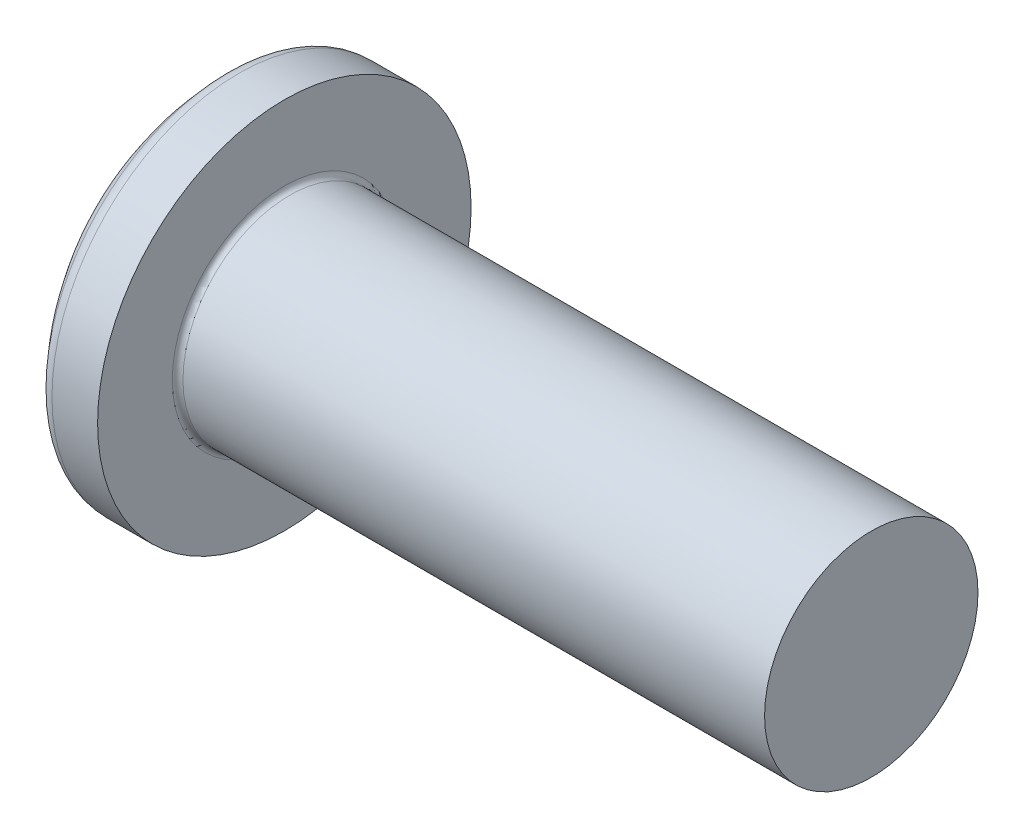
from build123d import *

# Parameters (mm, degrees)
FILLET1_R    = 0.1
RECPAT_COUNT = 2
RECPAT_ANGLE = 90


with BuildPart() as part:
    # BodySke → Base-Revolve (revolve)
    with BuildSketch(Plane.XY, mode=Mode.PRIVATE) as base_revolve_sk:
        with BuildLine():
            Line((2.4, 2), (2.4, 3.5))
            Line((2.4, 3.5), (1.544569491, 3.5))
            ThreePointArc((1.544569491, 3.5), (1.437055787, 3.477670756), (1.347325044, 3.414376321))
            ThreePointArc((1.347325044, 3.414376321), (0.349012213, 1.835296327), (0, 0))
            Line((0, 0), (13.4, 0))
            Line((13.4, 0), (13.4, 2))
            Line((13.4, 2), (2.4, 2))
        make_face()
    revolve(base_revolve_sk.sketch.rotate(Axis((1.544569491, 0, 0), (1, 0, 0)), 90), axis=Axis((1.544569491, 0, 0), (1, 0, 0)))

    # Fillet1
    fillet1_edges = [part.edges().sort_by_distance(p)[0] for p in [
        (2.4, 0, -2),
    ]]
    fillet(fillet1_edges, radius=FILLET1_R)

    # Sketch3 → Recess section 0
    with BuildSketch(Plane(origin=(0, 0, 0), x_dir=(0, 0, -1), z_dir=(1, 0, 0))):
        with BuildLine():
            Line((0.37, -1.4), (-0.37, -1.4))
            Line((-0.37, -1.4), (-0.37, 1.4))
            Line((-0.37, 1.4), (0.37, 1.4))
            Line((0.37, 1.4), (0.37, -1.4))
        make_face()
    # Sketch4 → Recess section 1
    with BuildSketch(Plane(origin=(1.75, 0, 0), x_dir=(0, 0, -1), z_dir=(1, 0, 0))):
        with BuildLine():
            Line((0.37, -0.527482332), (-0.37, -0.527482332))
            Line((-0.37, -0.527482332), (-0.37, 0.527482332))
            Line((-0.37, 0.527482332), (0.37, 0.527482332))
            Line((0.37, 0.527482332), (0.37, -0.527482332))
        make_face()
    recess = loft(mode=Mode.SUBTRACT)

    # RecPat: Recess ×2 about axis
    recpat_axis = Axis((0, 0, 0), (1, 0, 0))
    for i in range(1, RECPAT_COUNT):
        add(recess.rotate(recpat_axis, i * RECPAT_ANGLE / (RECPAT_COUNT - 1)), mode=Mode.SUBTRACT)

    # RecCorSke → RecessCore (revolve, cut)
    with BuildSketch(Plane.XY, mode=Mode.PRIVATE) as recesscore_sk:
        Polygon((0, 0), (0, 0.678371921), (1.75, 0.556), (1.930655351, 0), align=None)
    revolve(recesscore_sk.sketch.rotate(Axis((-3.175, 0, 0), (1, 0, 0)), 15.814025638), axis=Axis((-3.175, 0, 0), (1, 0, 0)), mode=Mode.SUBTRACT)


solid = part.part
